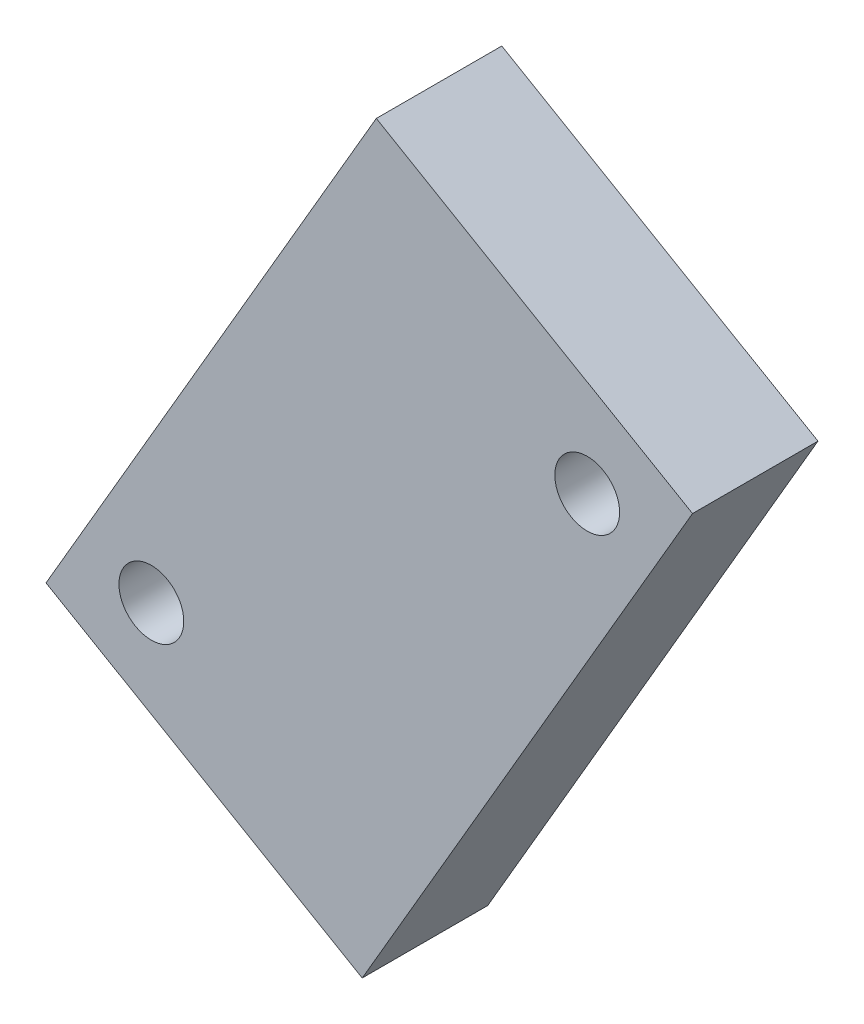
from build123d import *

# Parameters (mm, degrees)
DODANIE_WYCI_GNI_CIE1_DEPTH = 6
SZKIC2_R                    = 1.55
WYTNIJ_WYCI_GNI_CIE1_DEPTH  = 6


with BuildPart() as part:
    # Szkic1 → Dodanie-wyciągnięcie1 (new body)
    with BuildSketch(Plane.XY):
        Polygon((437.49992202, 37.438636987), (452.623977701, 28.634493658), (468.421126301, 55.77137071), (453.29707062, 64.575514038), align=None)
    extrude(amount=DODANIE_WYCI_GNI_CIE1_DEPTH)

    # Szkic2 → Wytnij-wyciągnięcie1 (cut)
    with BuildSketch(Plane.XY.offset(6)):
        with Locations((463.383939547, 54.075272363)):
            Circle(SZKIC2_R)
        with Locations((442.537108774, 39.134735334)):
            Circle(SZKIC2_R)
    extrude(amount=-WYTNIJ_WYCI_GNI_CIE1_DEPTH, mode=Mode.SUBTRACT)


solid = part.part
